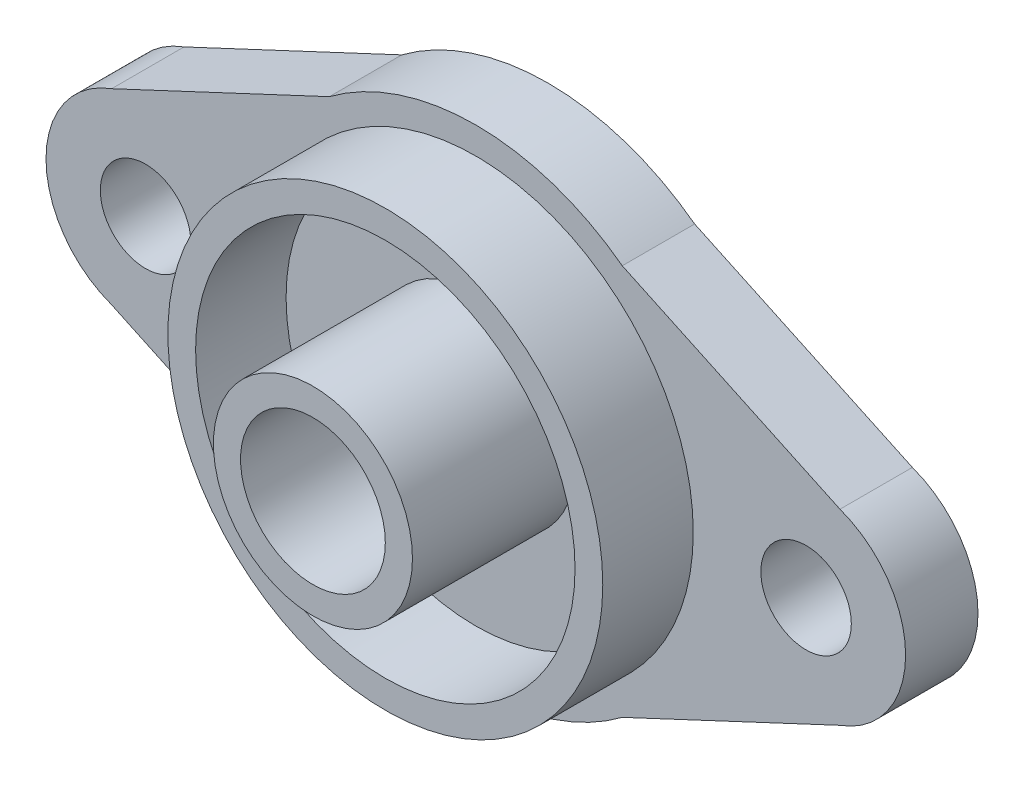
from build123d import *

# Parameters (mm, degrees)
ESBO_O1_R                = 4
ESBO_O1_R_2              = 2.5
RESSALTO_EXTRUS_O1_DEPTH = 4
ESBO_O2_R                = 12.015701032
ESBO_O2_R_2              = 10.48384183
RESSALTO_EXTRUS_O2_DEPTH = 5
ESBO_O3_R                = 5.5
ESBO_O3_R_2              = 4
RESSALTO_EXTRUS_O3_DEPTH = 9


with BuildPart() as part:
    # Esboço1 → Ressalto-extrusão1 (new body)
    with BuildSketch(Plane.XY):
        with BuildLine():
            Line((-20.12399727, 5.170892982), (-8.093718556, 10.80470823))
            ThreePointArc((-8.093718556, 10.80470823), (0, 13.5), (8.093718556, 10.80470823))
            Line((8.093718556, 10.80470823), (20.12399727, 5.170892982))
            ThreePointArc((20.12399727, 5.170892982), (23.75, 0), (20.12399727, -5.170892982))
            Line((20.12399727, -5.170892982), (8.093718556, -10.80470823))
            ThreePointArc((8.093718556, -10.80470823), (0, -13.5), (-8.093718556, -10.80470823))
            Line((-8.093718556, -10.80470823), (-20.12399727, -5.170892982))
            ThreePointArc((-20.12399727, -5.170892982), (-23.75, 0), (-20.12399727, 5.170892982))
        make_face()
        Circle(ESBO_O1_R, mode=Mode.SUBTRACT)
        with Locations((-18.25, 0)):
            Circle(ESBO_O1_R_2, mode=Mode.SUBTRACT)
        with Locations((18.25, 0)):
            Circle(ESBO_O1_R_2, mode=Mode.SUBTRACT)
    extrude(amount=RESSALTO_EXTRUS_O1_DEPTH)

    # Esboço2 → Ressalto-extrusão2 (add)
    with BuildSketch(Plane.XY.offset(4)):
        Circle(ESBO_O2_R)
        Circle(ESBO_O2_R_2, mode=Mode.SUBTRACT)
    extrude(amount=RESSALTO_EXTRUS_O2_DEPTH)

    # Esboço3 → Ressalto-extrusão3 (add)
    with BuildSketch(Plane.XY.offset(4)):
        Circle(ESBO_O3_R)
        Circle(ESBO_O3_R_2, mode=Mode.SUBTRACT)
    extrude(amount=RESSALTO_EXTRUS_O3_DEPTH)


solid = part.part
